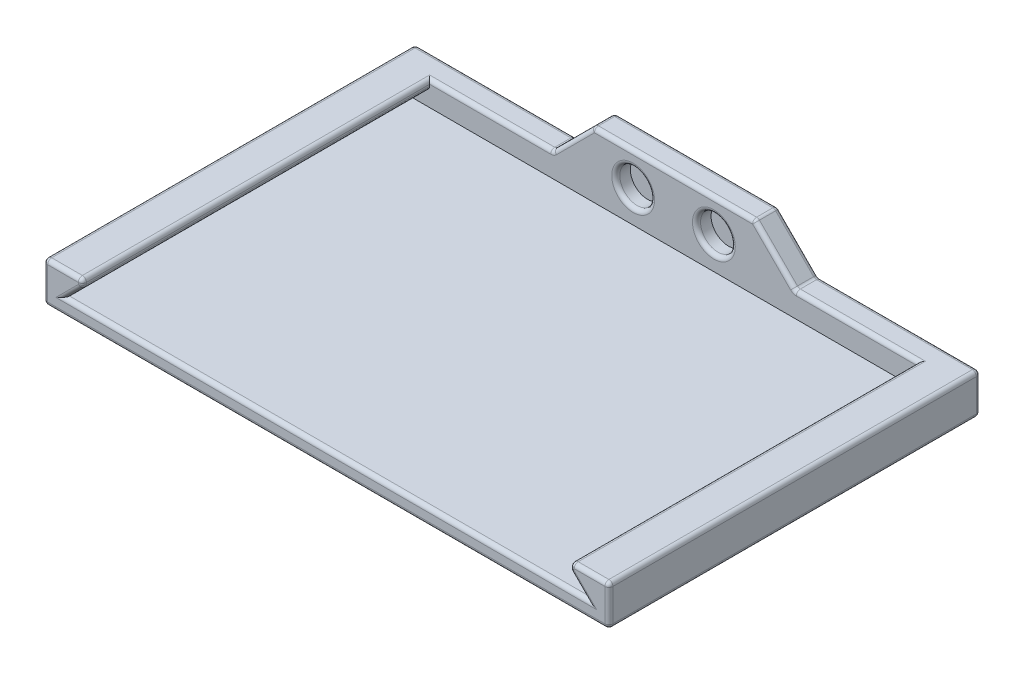
from build123d import *

# Parameters (mm, degrees)
BOSS_EXTRUDE1_DEPTH = 43
BOSS_EXTRUDE2_DEPTH = 3
SKETCH1_5_R         = 2.15
CUT_EXTRUDE1_DEPTH  = 1.8
FILLET1_R           = 0.5


with BuildPart() as part:
    # Sketch1 → Boss-Extrude1 (new body)
    with BuildSketch(Plane.XY):
        Polygon((4.8, 3), (0, 3), (0, -2), (35, -2), (35, 0), (3, 0), (2.717157288, 0), (2.858578644, 0.141421356), (4.8, 2.082842712), align=None)
    extrude(amount=BOSS_EXTRUDE1_DEPTH)

    # Sketch1<3> → Boss-Extrude2 (add)
    with BuildSketch(Plane.XY):
        Polygon((0, 3), (0, -2), (35, -2), (35, 8), (25, 8), (20, 3), align=None)
    extrude(amount=-BOSS_EXTRUDE2_DEPTH)

    # Sketch1<5> → Cut-Extrude1 (cut)
    with BuildSketch(Plane.XY):
        with Locations((30, 4)):
            Circle(SKETCH1_5_R)
    extrude(amount=-CUT_EXTRUDE1_DEPTH, mode=Mode.SUBTRACT)

    # Mirror1: part across plane


with BuildPart() as part_1:
    add(part.part)
    add(part.part.mirror(Plane(origin=(35, 0, 43), x_dir=(0, 0, 1), z_dir=(-1, 0, 0))))

    # Fillet1
    fillet1_edges = [part_1.edges().sort_by_distance(p)[0] for p in [
        (47.5, 5.5, 0),
        (22.5, 5.5, 0),
        (66.241421356, 1.041421356, 43),
        (65.2, 2.541421356, 43),
        (4.8, 2.541421356, 43),
        (3.758578644, 1.041421356, 43),
        (35, 0, 43),
        (0, 0.5, 43),
        (70, 0.5, 43),
        (35, -2, 43),
        (70, -2, 20),
        (0, -2, 20),
        (22.5, 5.5, -3),
        (0, 0.5, -3),
        (35, -2, -3),
        (70, 0.5, -3),
        (47.5, 5.5, -3),
        (25, 8, -1.5),
        (35, 8, -3),
        (45, 8, -1.5),
        (35, 8, 0),
        (57.6, 3, 0),
        (50, 3, -1.5),
        (60, 3, -3),
        (70, 3, 20),
        (67.6, 3, 43),
        (65.2, 3, 21.5),
        (2.4, 3, 43),
        (0, 3, 20),
        (10, 3, -3),
        (20, 3, -1.5),
        (12.4, 3, 0),
        (4.8, 3, 21.5),
        (4.8, 2.082842712, 21.5),
        (65.2, 2.082842712, 21.5),
        (27.85, 4, 0),
        (42.15, 4, 0),
    ]]
    fillet(fillet1_edges, radius=FILLET1_R)


solid = part_1.part
